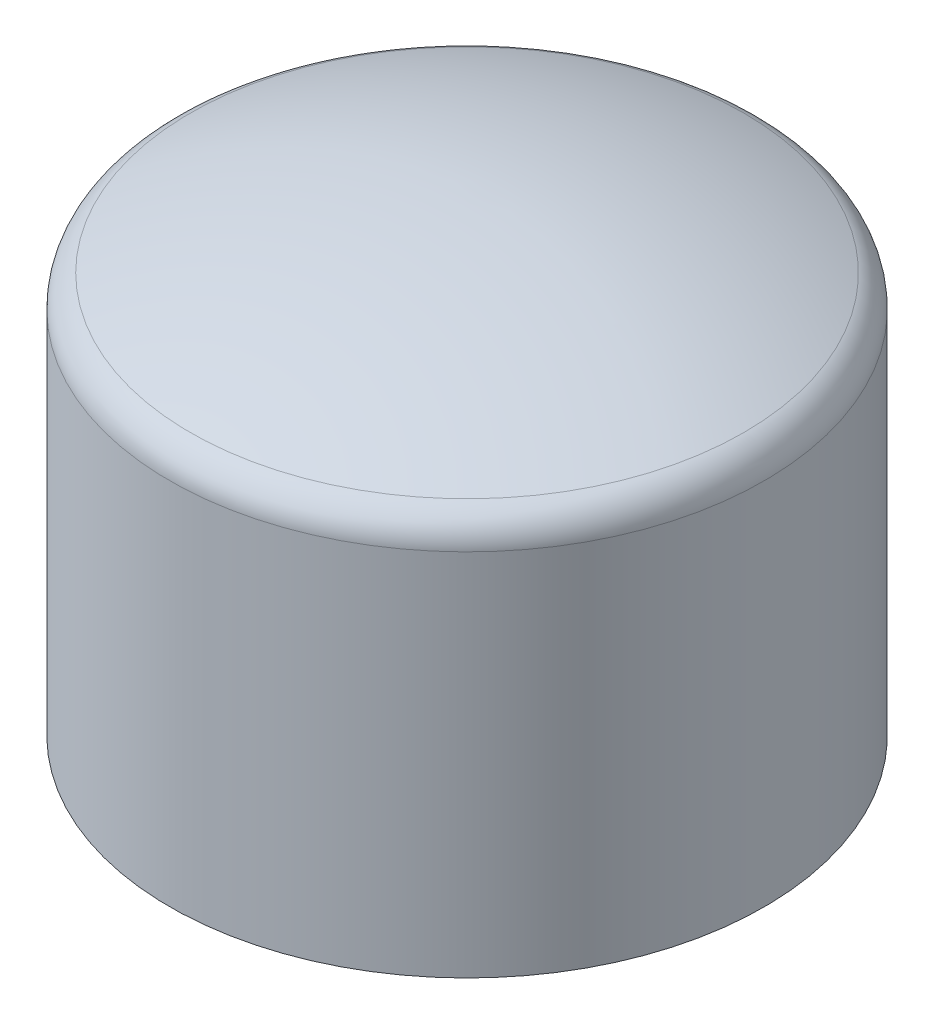
from build123d import *

# Parameters (mm, degrees)
FILLET1_R = 2.54


with BuildPart() as part:
    # Sketch1 → Revolve1 (revolve)
    with BuildSketch(Plane.XY, mode=Mode.PRIVATE) as revolve1_sk:
        with BuildLine():
            Line((16.7005, 0), (21.844, 0))
            Line((21.844, 0), (21.844, 28.738230656))
            ThreePointArc((21.844, 28.738230656), (11.209370468, 32.504684634), (0, 33.782))
            Line((0, 33.782), (0, 28.6385))
            ThreePointArc((0, 28.6385), (8.505800705, 27.821403633), (16.7005, 25.4))
            Line((16.7005, 25.4), (16.7005, 0))
        make_face()
    revolve(revolve1_sk.sketch.rotate(Axis((0, 0, 0), (0, 1, 0)), 90), axis=Axis((0, 0, 0), (0, 1, 0)))

    # Fillet1
    fillet1_edges = [part.edges().sort_by_distance(p)[0] for p in [
        (0, 25.4, 16.7005),
        (0, 28.738230656, 21.844),
    ]]
    fillet(fillet1_edges, radius=FILLET1_R)


solid = part.part
